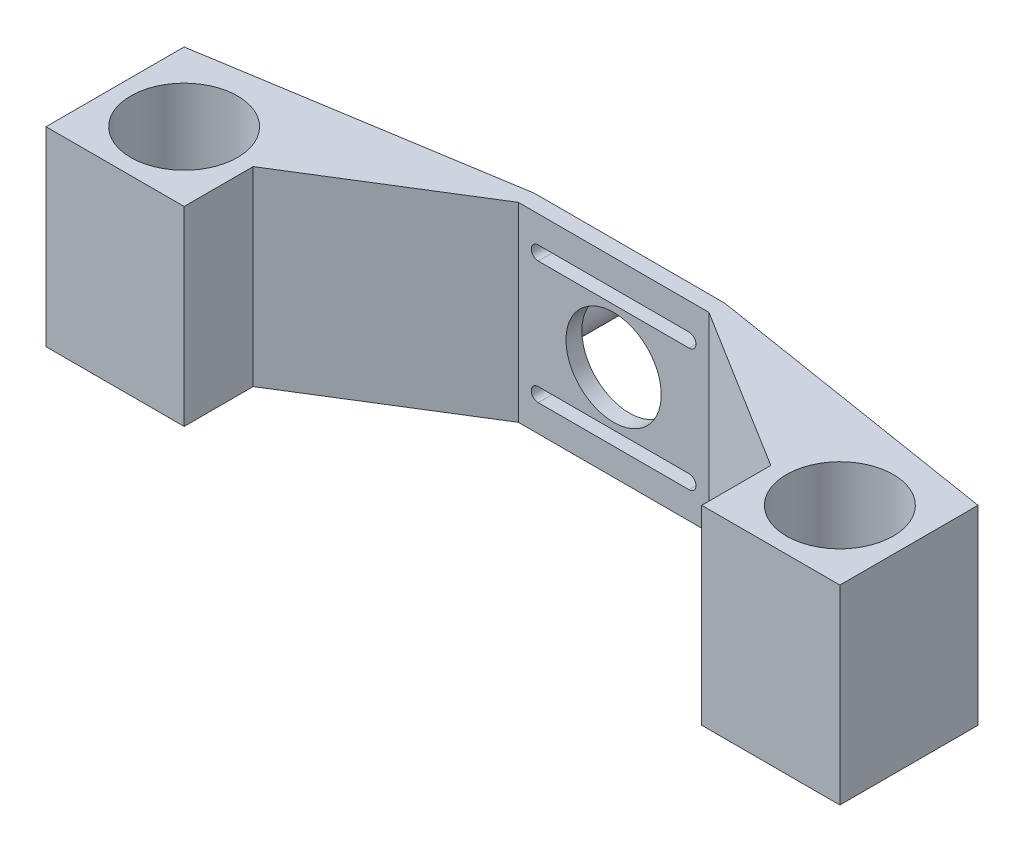
from build123d import *

# Parameters (mm, degrees)
SKETCH2_R           = 13.45
BOSS_EXTRUDE1_DEPTH = 48
SKETCH4_R           = 12
CUT_EXTRUDE1_DEPTH  = 48
SKETCH5_R           = 7
SKETCH5_R_2         = 4
BOSS_EXTRUDE2_DEPTH = 2
BOSS_EXTRUDE3_START = 13
SKETCH6_R           = 7
SKETCH6_R_2         = 4
BOSS_EXTRUDE3_DEPTH = 13


with BuildPart() as part:
    # Sketch2 → Boss-Extrude1 (new body)
    with BuildSketch(Plane(origin=(0, 0, 0), x_dir=(1, 0, 0), z_dir=(0, 1, 0))):
        Polygon((-17.4, -17.4), (17.4, -17.4), (17.4, 0), (58.6, 25.6), (82.6, 25.6), (82.6, 29.6), (58.6, 29.6), (-17.4, 17.4), align=None)
        with Locations(Location((0, 0, 0), (0, 0, 270))):
            Circle(SKETCH2_R, mode=Mode.SUBTRACT)
    boss_extrude1 = extrude(amount=BOSS_EXTRUDE1_DEPTH)

    # Mirror1: Boss-Extrude1 across plane
    add(boss_extrude1.mirror(Plane(origin=(82.6, 0, 0), x_dir=(0, 0, 1), z_dir=(1, 0, 0))))

    # Sketch4 → Cut-Extrude1 (cut)
    with BuildSketch(Plane(origin=(0, 0, -29.6), x_dir=(-1, 0, 0), z_dir=(0, 0, -1))):
        with Locations((-82.6, 24)):
            Circle(SKETCH4_R)
        with BuildLine():
            Line((-101.6, 10.3), (-63.6, 10.3))
            ThreePointArc((-63.6, 10.3), (-61.85, 8.55), (-63.6, 6.8))
            Line((-63.6, 6.8), (-101.6, 6.8))
            ThreePointArc((-101.6, 6.8), (-103.35, 8.55), (-101.6, 10.3))
        make_face()
        with BuildLine():
            Line((-101.6, 37.7), (-63.6, 37.7))
            ThreePointArc((-63.6, 37.7), (-61.85, 39.45), (-63.6, 41.2))
            Line((-63.6, 41.2), (-101.6, 41.2))
            ThreePointArc((-101.6, 41.2), (-103.35, 39.45), (-101.6, 37.7))
        make_face()
    extrude(amount=-CUT_EXTRUDE1_DEPTH, mode=Mode.SUBTRACT)

    # Sketch5 → Boss-Extrude2 (add)
    with BuildSketch(Plane(origin=(0, 0, -29.6), x_dir=(-1, 0, 0), z_dir=(0, 0, -1))):
        with Locations((-62.1, 24)):
            Circle(SKETCH5_R)
        with Locations((-62.1, 24)):
            Circle(SKETCH5_R_2, mode=Mode.SUBTRACT)
    extrude(amount=-BOSS_EXTRUDE2_DEPTH)

    # Sketch6 → Boss-Extrude3 (add)
    with BuildSketch(Plane(origin=(0, 0, -29.6), x_dir=(-1, 0, 0), z_dir=(0, 0, -1)).offset(BOSS_EXTRUDE3_START)):
        with Locations((-62.1, 24)):
            Circle(SKETCH6_R)
        with Locations((-62.1, 24)):
            Circle(SKETCH6_R_2, mode=Mode.SUBTRACT)
    extrude(amount=-BOSS_EXTRUDE3_DEPTH)


solid = part.part
